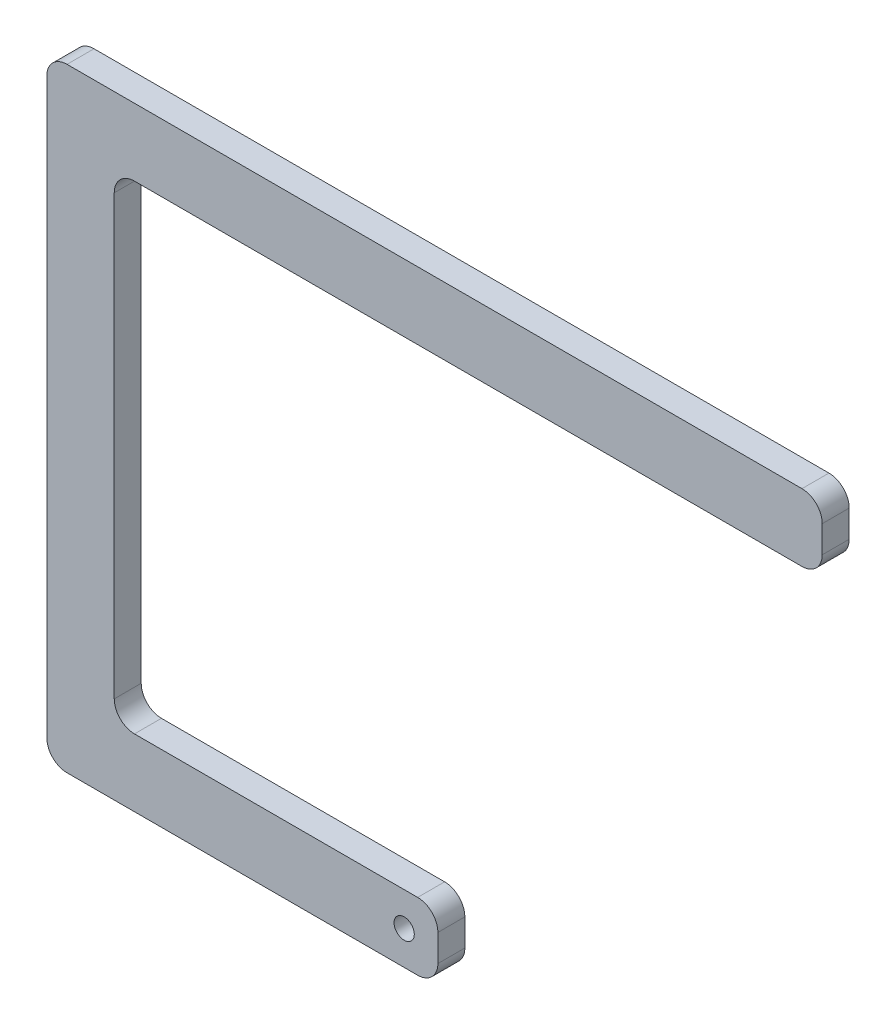
from build123d import *

# Parameters (mm, degrees)
SKETCH1_R           = 1.5
BOSS_EXTRUDE1_DEPTH = 4


with BuildPart() as part:
    # Sketch1 → Boss-Extrude1 (new body)
    with BuildSketch(Plane.XY):
        with BuildLine():
            Line((-3, 0), (-45, 0))
            ThreePointArc((-45, 0), (-47.121320344, 0.878679656), (-48, 3))
            Line((-48, 3), (-48, 68))
            ThreePointArc((-48, 68), (-47.121320344, 70.121320344), (-45, 71))
            Line((-45, 71), (54, 71))
            ThreePointArc((54, 71), (56.121320344, 71.878679656), (57, 74))
            Line((57, 74), (57, 78))
            ThreePointArc((57, 78), (56.121320344, 80.121320344), (54, 81))
            Line((54, 81), (-55, 81))
            ThreePointArc((-55, 81), (-57.121320344, 80.121320344), (-58, 78))
            Line((-58, 78), (-58, -7))
            ThreePointArc((-58, -7), (-57.121320344, -9.121320344), (-55, -10))
            Line((-55, -10), (-3, -10))
            ThreePointArc((-3, -10), (-0.878679656, -9.121320344), (0, -7))
            Line((0, -7), (0, -3))
            ThreePointArc((0, -3), (-0.878679656, -0.878679656), (-3, 0))
        make_face()
        with Locations((-5, -5)):
            Circle(SKETCH1_R, mode=Mode.SUBTRACT)
    extrude(amount=BOSS_EXTRUDE1_DEPTH)


solid = part.part
